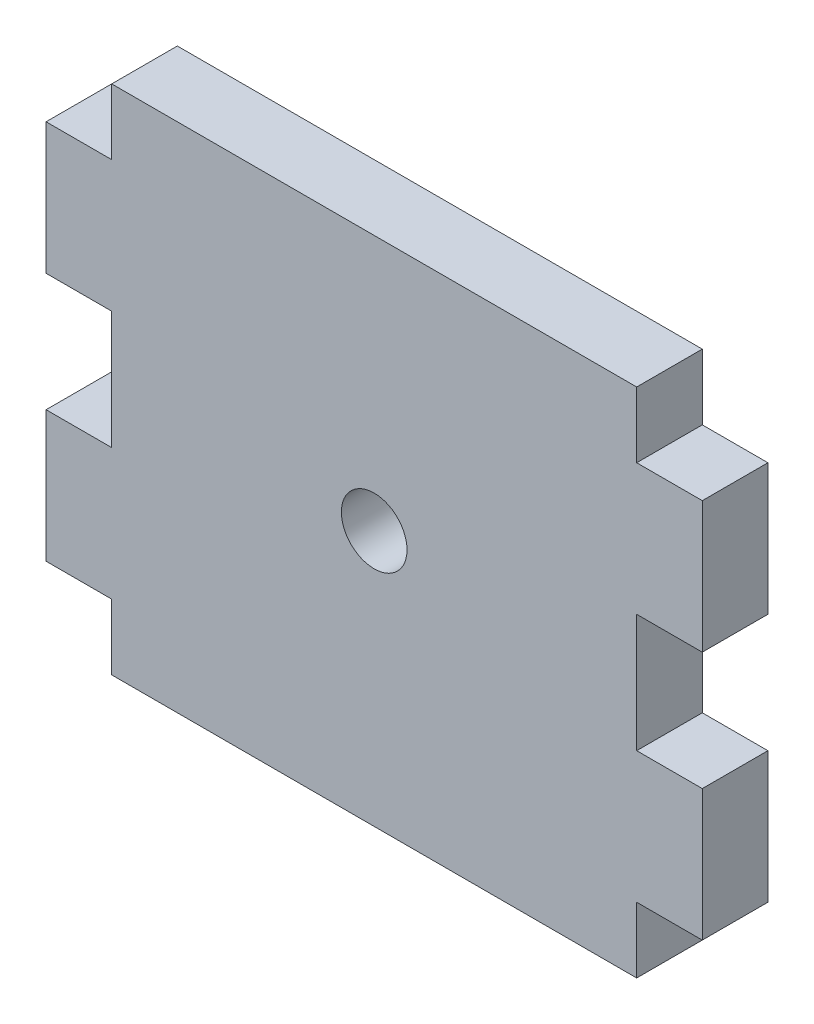
from build123d import *

# Parameters (mm, degrees)
SKETCH1_R           = 2.5
BOSS_EXTRUDE1_DEPTH = 5


with BuildPart() as part:
    # Sketch1 → Boss-Extrude1 (new body)
    with BuildSketch(Plane.XY):
        Polygon((-25, 14.5), (-20, 14.5), (-20, 19.5), (20, 19.5), (20, 14.5), (25, 14.5), (25, 4.5), (20, 4.5), (20, -4.5), (25, -4.5), (25, -14.5), (20, -14.5), (20, -19.5), (-20, -19.5), (-20, -14.5), (-25, -14.5), (-25, -4.5), (-20, -4.5), (-20, 4.5), (-25, 4.5), align=None)
        Circle(SKETCH1_R, mode=Mode.SUBTRACT)
    extrude(amount=BOSS_EXTRUDE1_DEPTH)


solid = part.part
